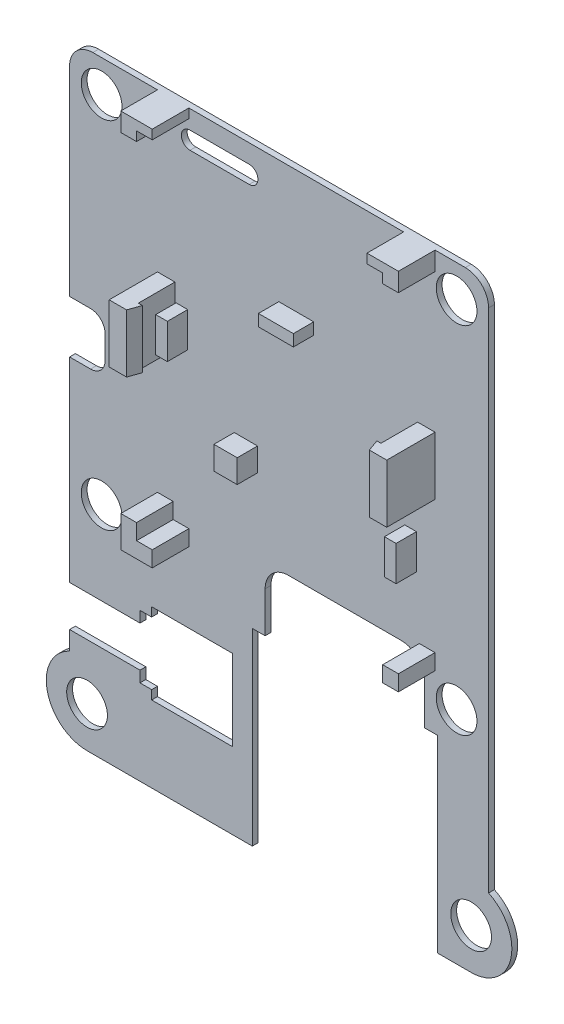
from build123d import *

# Parameters (mm, degrees)
SKETCH1_R           = 1.75
BASE_SHAPE_DEPTH    = 0.5
SKETCH2_W           = 3
SKETCH2_H           = 1
SKETCH2_W_2         = 1
SKETCH2_H_2         = 3
SKETCH2_W_3         = 2
SKETCH2_H_3         = 2
RX_SUPPORTS_DEPTH   = 1.75
SKETCH3_W           = 1.5
SKETCH3_H           = 5
CLIP_BASE_DEPTH     = 3.15
SKETCH4_W           = 1.85
SKETCH4_H           = 5
CLIP_TOP_DEPTH      = 1
CLIP_CHAMFER_REACH  = 41.42
SKETCH6_W           = 1.35
SKETCH6_H           = 1.35
BOSS_EXTRUDE1_DEPTH = 3.15


with BuildPart() as part:
    # Sketch1 → Base shape (new body)
    with BuildSketch(Plane.XY):
        with BuildLine():
            Line((18, -27.53772234), (18, 16))
            ThreePointArc((18, 16), (17.414213562, 17.414213562), (16, 18))
            Line((16, 18), (-16, 18))
            ThreePointArc((-16, 18), (-17.414213562, 17.414213562), (-18, 16))
            Line((-18, 16), (-18, -1.15))
            Line((-18, -1.15), (-16.2, -1.15))
            ThreePointArc((-16.2, -1.15), (-15.316116524, -1.516116524), (-14.95, -2.4))
            Line((-14.95, -2.4), (-14.95, -4.4))
            ThreePointArc((-14.95, -4.4), (-15.316116524, -5.283883476), (-16.2, -5.65))
            Line((-16.2, -5.65), (-18, -5.65))
            Line((-18, -5.65), (-18, -22.43))
            Line((-18, -22.43), (-11.95, -22.43))
            Line((-11.95, -22.43), (-11.95, -21.48))
            Line((-11.95, -21.48), (-10.95, -21.48))
            Line((-10.95, -21.48), (-10.95, -20.71))
            Line((-10.95, -20.71), (-4.01, -20.71))
            Line((-4.01, -20.71), (-4.01, -27.65))
            Line((-4.01, -27.65), (-10.95, -27.65))
            Line((-10.95, -27.65), (-10.95, -26.88))
            Line((-10.95, -26.88), (-11.95, -26.88))
            Line((-11.95, -26.88), (-11.95, -25.93))
            Line((-11.95, -25.93), (-18, -25.93))
            Line((-18, -25.93), (-18, -27.53772234))
            ThreePointArc((-18, -27.53772234), (-19.914525722, -31.468774411), (-16.5, -34.2))
            Line((-16.5, -34.2), (-2.3, -34.2))
            Line((-2.3, -34.2), (-2.3, -18))
            Line((-2.3, -18), (-1.2, -18))
            Line((-1.2, -18), (-1.2, -14.5))
            ThreePointArc((-1.2, -14.5), (-0.614213562, -13.085786438), (0.8, -12.5))
            Line((0.8, -12.5), (10.5, -12.5))
            ThreePointArc((10.5, -12.5), (11.914213562, -13.085786438), (12.5, -14.5))
            Line((12.5, -14.5), (12.5, -18))
            Line((12.5, -18), (13.6, -18))
            Line((13.6, -18), (13.6, -34.2))
            Line((13.6, -34.2), (16.5, -34.2))
            ThreePointArc((16.5, -34.2), (19.914525722, -31.468774411), (18, -27.53772234))
        make_face()
        with Locations((16.5, -30.7)):
            Circle(SKETCH1_R, mode=Mode.SUBTRACT)
        with Locations((15.25, 15.25)):
            Circle(SKETCH1_R, mode=Mode.SUBTRACT)
        with Locations((-15.25, -15.25)):
            Circle(SKETCH1_R, mode=Mode.SUBTRACT)
        with Locations((15.25, -15.25)):
            Circle(SKETCH1_R, mode=Mode.SUBTRACT)
        with Locations((-15.25, 15.25)):
            Circle(SKETCH1_R, mode=Mode.SUBTRACT)
        with BuildLine():
            ThreePointArc((-7.65, 14.9), (-8.4, 15.65), (-7.65, 16.4))
            Line((-7.65, 16.4), (-2.57, 16.4))
            ThreePointArc((-2.57, 16.4), (-1.82, 15.65), (-2.57, 14.9))
            Line((-2.57, 14.9), (-7.65, 14.9))
        make_face(mode=Mode.SUBTRACT)
        with Locations((-16.5, -30.7)):
            Circle(SKETCH1_R, mode=Mode.SUBTRACT)
    extrude(amount=BASE_SHAPE_DEPTH)

    # Sketch2 → RX supports (add)
    with BuildSketch(Plane.XY.offset(0.5)):
        with Locations((1.475, 6.95)):
            Rectangle(SKETCH2_W, SKETCH2_H)
        with Locations((-8.35, 1.45)):
            Rectangle(SKETCH2_W_2, SKETCH2_H_2)
        with Locations((-2.85, -5.2)):
            Rectangle(SKETCH2_W_3, SKETCH2_H_3)
        with Locations((11.3, 0.45)):
            Rectangle(SKETCH2_W_2, SKETCH2_H_2)
        with Locations((11.3, -5.25)):
            Rectangle(SKETCH2_W_2, SKETCH2_H_2)
    extrude(amount=RX_SUPPORTS_DEPTH)

    # Sketch3 → Clip base (add)
    with BuildSketch(Plane.XY.offset(0.5)):
        with Locations((-9.7, 1.95)):
            Rectangle(SKETCH3_W, SKETCH3_H)
        with Locations((12.65, 1.95)):
            Rectangle(SKETCH3_W, SKETCH3_H)
    extrude(amount=CLIP_BASE_DEPTH)

    # Sketch4 → Clip top (add)
    with BuildSketch(Plane.XY.offset(3.65)):
        with Locations((-9.525, 1.95)):
            Rectangle(SKETCH4_W, SKETCH4_H)
        with Locations((12.475, 1.95)):
            Rectangle(SKETCH4_W, SKETCH4_H)
    extrude(amount=CLIP_TOP_DEPTH)

    # Sketch5 → Clip chamfer (cut, up to next)
    with BuildSketch(Plane.XZ.offset(0.55), mode=Mode.PRIVATE) as clip_chamfer_sk1:
        Polygon((-8.6, 3.65), (-8.95, 4.65), (-8.6, 4.65), align=None)
    clip_chamfer_tool1 = extrude(clip_chamfer_sk1.sketch, amount=-CLIP_CHAMFER_REACH, mode=Mode.PRIVATE) & part.part
    # Sketch5 → Clip chamfer (cut, up to next)
    with BuildSketch(Plane.XZ.offset(0.55), mode=Mode.PRIVATE) as clip_chamfer_sk2:
        Polygon((11.55, 3.65), (11.9, 4.65), (11.55, 4.65), align=None)
    clip_chamfer_tool2 = extrude(clip_chamfer_sk2.sketch, amount=-CLIP_CHAMFER_REACH, mode=Mode.PRIVATE) & part.part
    add(clip_chamfer_tool1.solids().sort_by_distance((-8.716667, -0.55, 4.316667))[0], mode=Mode.SUBTRACT)
    add(clip_chamfer_tool2.solids().sort_by_distance((11.666667, -0.55, 4.316667))[0], mode=Mode.SUBTRACT)

    # Sketch6 → Boss-Extrude1 (add)
    with BuildSketch(Plane.XY.offset(0.5)):
        Polygon((-9.1, 17.2), (-7.75, 17.2), (-7.75, 18), (-10.45, 18), (-10.45, 16.4), (-9.1, 16.4), align=None)
        Polygon((13.4, 18), (10.7, 18), (10.7, 17.2), (12.05, 17.2), (12.05, 16.4), (13.4, 16.4), align=None)
        with Locations((12.725, -12.625)):
            Rectangle(SKETCH6_W, SKETCH6_H)
        Polygon((-9.1, -13.3), (-9.1, -11.95), (-10.45, -11.95), (-10.45, -14.65), (-7.75, -14.65), (-7.75, -13.3), align=None)
    extrude(amount=BOSS_EXTRUDE1_DEPTH)


solid = part.part
